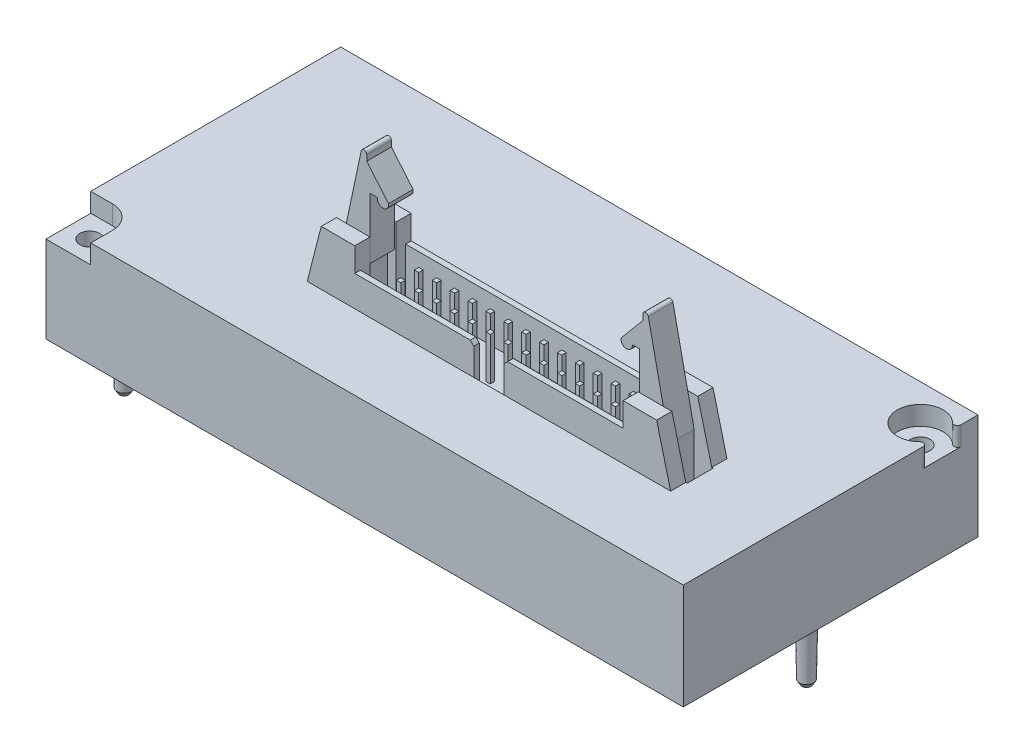
from build123d import *

# Parameters (mm, degrees)
SKETCH1_W                = 90.5
SKETCH1_H                = 41.85
SKETCH1_R                = 1.4
BOSS_EXTRUDE1_DEPTH      = 15
SKETCH2_W                = 105
SKETCH2_H                = 60
CUT_EXTRUDE1_DEPTH       = 2.7
BOSS_EXTRUDE2_DEPTH      = 4
BOSS_EXTRUDE2_DEPTH_BACK = 4
CUT_EXTRUDE2_DEPTH       = 6.4
CUT_EXTRUDE2_DEPTH_BACK  = 6.4
SKETCH7_W                = 38.1
SKETCH7_H                = 6.43
CUT_EXTRUDE3_DEPTH       = 1
SKETCH9_W                = 3.68
SKETCH9_H                = 13
CUT_EXTRUDE4_DEPTH       = 7
SKETCH10_W               = 3.68
SKETCH10_H               = 13
CUT_EXTRUDE5_DEPTH       = 7
BOSS_EXTRUDE3_DEPTH      = 3
BOSS_EXTRUDE3_DEPTH_BACK = 3
SKETCH11_R               = 0.5
BOSS_EXTRUDE4_DEPTH      = 3
BOSS_EXTRUDE4_DEPTH_BACK = 3
SKETCH12_R               = 0.5
BOSS_EXTRUDE5_DEPTH      = 1.75
BOSS_EXTRUDE5_DEPTH_BACK = 1.75
BOSS_EXTRUDE6_DEPTH      = 1.75
BOSS_EXTRUDE6_DEPTH_BACK = 1.75
SKETCH15_W               = 0.62
SKETCH15_H               = 0.62
BOSS_EXTRUDE7_DEPTH      = 6.1
SKETCH16_W               = 0.62
SKETCH16_H               = 0.62
BOSS_EXTRUDE8_DEPTH      = 6.1
SKETCH17_W               = 0.62
SKETCH17_H               = 0.62
BOSS_EXTRUDE9_DEPTH      = 6.1
SKETCH18_W               = 0.62
SKETCH18_H               = 0.62
BOSS_EXTRUDE10_DEPTH     = 6.1
SKETCH19_W               = 0.62
SKETCH19_H               = 0.62
BOSS_EXTRUDE11_DEPTH     = 6.1
SKETCH20_W               = 0.62
SKETCH20_H               = 0.62
BOSS_EXTRUDE12_DEPTH     = 6.1
SKETCH21_W               = 0.62
SKETCH21_H               = 0.62
BOSS_EXTRUDE13_DEPTH     = 6.1
SKETCH22_W               = 0.62
SKETCH22_H               = 0.62
BOSS_EXTRUDE14_DEPTH     = 6.1
SKETCH23_W               = 0.62
SKETCH23_H               = 0.62
BOSS_EXTRUDE15_DEPTH     = 6.1
SKETCH24_W               = 0.62
SKETCH24_H               = 0.62
BOSS_EXTRUDE16_DEPTH     = 6.1
SKETCH25_W               = 0.62
SKETCH25_H               = 0.62
BOSS_EXTRUDE17_DEPTH     = 6.1
SKETCH26_W               = 0.62
SKETCH26_H               = 0.62
BOSS_EXTRUDE18_DEPTH     = 6.1
SKETCH27_W               = 0.62
SKETCH27_H               = 0.62
BOSS_EXTRUDE19_DEPTH     = 6.1
SKETCH28_W               = 0.62
SKETCH28_H               = 0.62
BOSS_EXTRUDE20_DEPTH     = 6.1
SKETCH29_W               = 0.62
SKETCH29_H               = 0.62
BOSS_EXTRUDE21_DEPTH     = 6.1
SKETCH30_W               = 0.62
SKETCH30_H               = 0.62
BOSS_EXTRUDE22_DEPTH     = 6.1
SKETCH31_W               = 0.62
SKETCH31_H               = 0.62
BOSS_EXTRUDE23_DEPTH     = 6.1
SKETCH32_W               = 0.62
SKETCH32_H               = 0.62
BOSS_EXTRUDE24_DEPTH     = 6.1
SKETCH33_W               = 0.62
SKETCH33_H               = 0.62
BOSS_EXTRUDE25_DEPTH     = 6.1
SKETCH34_W               = 0.62
SKETCH34_H               = 0.62
BOSS_EXTRUDE26_DEPTH     = 6.1
SKETCH35_W               = 0.62
SKETCH35_H               = 0.62
BOSS_EXTRUDE27_DEPTH     = 6.1
SKETCH36_W               = 0.62
SKETCH36_H               = 0.62
BOSS_EXTRUDE28_DEPTH     = 6.1
SKETCH37_W               = 0.62
SKETCH37_H               = 0.62
BOSS_EXTRUDE29_DEPTH     = 6.1
SKETCH38_W               = 0.62
SKETCH38_H               = 0.62
BOSS_EXTRUDE30_DEPTH     = 6.1
SKETCH39_W               = 0.62
SKETCH39_H               = 0.62
BOSS_EXTRUDE31_DEPTH     = 6.1
SKETCH40_W               = 0.62
SKETCH40_H               = 0.62
BOSS_EXTRUDE32_DEPTH     = 6.1


with BuildPart() as part:
    # Sketch1 → Boss-Extrude1 (new body)
    with BuildSketch(Plane(origin=(0, 0, 0), x_dir=(1, 0, 0), z_dir=(0, 1, 0))):
        with Locations((11, -5.675)):
            Rectangle(SKETCH1_W, SKETCH1_H)
        with Locations(Location((53.15, 10.15, 0), (0, 0, 270))):
            Circle(SKETCH1_R, mode=Mode.SUBTRACT)
        with Locations(Location((-31.15, -23.5, 0), (0, 0, 270))):
            Circle(SKETCH1_R, mode=Mode.SUBTRACT)
    extrude(amount=BOSS_EXTRUDE1_DEPTH)

    # Sketch2 → Cut-Extrude1 (cut)
    with BuildSketch(Plane(origin=(0, 15, 0), x_dir=(1, 0, 0), z_dir=(0, 1, 0))):
        with Locations((12.5, -5)):
            Rectangle(SKETCH2_W, SKETCH2_H)
        with BuildLine():
            Line((-34.25, 15.25), (-34.25, -20.25))
            Line((-34.25, -20.25), (-31.15, -20.25))
            ThreePointArc((-31.15, -20.25), (-28.851902961, -21.201902961), (-27.9, -23.5))
            Line((-27.9, -23.5), (-27.9, -26.6))
            Line((-27.9, -26.6), (56.25, -26.6))
            Line((56.25, -26.6), (56.25, 7.447686177))
            ThreePointArc((56.25, 7.447686177), (55.945788972, 7.907758648), (55.403333286, 7.807994641))
            ThreePointArc((55.403333286, 7.807994641), (49.9, 10.150000033), (55.403333333, 12.492005314))
            ThreePointArc((55.403333333, 12.492005314), (55.945789002, 12.392241365), (56.25, 12.852313823))
            Line((56.25, 12.852313823), (56.25, 15.25))
            Line((56.25, 15.25), (-34.25, 15.25))
        make_face(mode=Mode.SUBTRACT)
    extrude(amount=-CUT_EXTRUDE1_DEPTH, mode=Mode.SUBTRACT)

    # Sketch3 → Revolve1 (revolve)
    with BuildSketch(Plane.XY.offset(6), mode=Mode.PRIVATE) as revolve1_sk:
        Polygon((53.15, 0), (54.3, 0), (54.15, -8.4), (53.8, -9), (53.15, -9), align=None)
    revolve(revolve1_sk.sketch.rotate(Axis((53.15, -9, 6), (0, 1, 0)), 270), axis=Axis((53.15, -9, 6), (0, 1, 0)))

    # Sketch4 → Revolve2 (revolve)
    with BuildSketch(Plane.XY.offset(-5.25), mode=Mode.PRIVATE) as revolve2_sk:
        Polygon((-31.15, 0), (-30, 0), (-30.15, -8.4), (-30.5, -9), (-31.15, -9), align=None)
    revolve(revolve2_sk.sketch.rotate(Axis((-31.15, -9, -5.25), (0, 1, 0)), 270), axis=Axis((-31.15, -9, -5.25), (0, 1, 0)))

    # Sketch5 → Revolve3 (revolve)
    with BuildSketch(Plane.XY.offset(18.6), mode=Mode.PRIVATE) as revolve3_sk:
        Polygon((-31.15, 0), (-30, 0), (-30.15, -8.4), (-30.5, -9), (-31.15, -9), align=None)
    revolve(revolve3_sk.sketch.rotate(Axis((-31.15, -9, 18.6), (0, 1, 0)), 270), axis=Axis((-31.15, -9, 18.6), (0, 1, 0)))

    # Sketch6 → Boss-Extrude2 (add, two sides: drawn at the far end of the back side and taken through both)
    with BuildSketch(Plane.XY.offset(11.95).offset(-BOSS_EXTRUDE2_DEPTH_BACK)):
        Polygon((-8.225, 13.35), (-8.225, 5.35), (44.225, 5.35), (44.225, 13.35), (41.815, 22.75), (37.05, 22.75), (37.05, 19.35), (-1.05, 19.35), (-1.05, 22.75), (-5.815, 22.75), align=None)
    extrude(amount=BOSS_EXTRUDE2_DEPTH + BOSS_EXTRUDE2_DEPTH_BACK)

    # Sketch7 → Cut-Extrude2 (cut, two sides: drawn at the far end of the back side and taken through both)
    with BuildSketch(Plane(origin=(0, 19.35, 0), x_dir=(1, 0, 0), z_dir=(0, 1, 0)).offset(-CUT_EXTRUDE2_DEPTH_BACK)):
        with Locations((18, -11.95)):
            Rectangle(SKETCH7_W, SKETCH7_H)
    extrude(amount=CUT_EXTRUDE2_DEPTH + CUT_EXTRUDE2_DEPTH_BACK, mode=Mode.SUBTRACT)

    # Sketch8 → Cut-Extrude3 (cut)
    with BuildSketch(Plane.XY.offset(15.95)):
        Polygon((15.35, 19.35), (15.85, 18.85), (15.85, 13.45), (16.35, 12.95), (19.65, 12.95), (20.15, 13.45), (20.15, 18.85), (20.65, 19.35), align=None)
    extrude(amount=-CUT_EXTRUDE3_DEPTH, mode=Mode.SUBTRACT)

    # Sketch9 → Cut-Extrude4 (cut)
    with BuildSketch(Plane(origin=(37, 0, 0), x_dir=(0, 0, -1), z_dir=(1, 0, 0))):
        with Locations((-11.95, 16.25)):
            Rectangle(SKETCH9_W, SKETCH9_H)
    extrude(amount=CUT_EXTRUDE4_DEPTH, mode=Mode.SUBTRACT)

    # Sketch10 → Cut-Extrude5 (cut)
    with BuildSketch(Plane(origin=(-1.05, 0, 0), x_dir=(0, 0, -1), z_dir=(1, 0, 0))):
        with Locations((-11.95, 16.25)):
            Rectangle(SKETCH10_W, SKETCH10_H)
    extrude(amount=-CUT_EXTRUDE5_DEPTH, mode=Mode.SUBTRACT)

    # Sketch11 → Boss-Extrude3 (add, two sides: drawn at the far end of the back side and taken through both)
    with BuildSketch(Plane.XY.offset(11.95).offset(-BOSS_EXTRUDE3_DEPTH_BACK)):
        with Locations(Location((40.225, 15.21, 0), (0, 0, 180))):
            Circle(SKETCH11_R)
    extrude(amount=BOSS_EXTRUDE3_DEPTH + BOSS_EXTRUDE3_DEPTH_BACK)

    # Sketch12 → Boss-Extrude4 (add, two sides: drawn at the far end of the back side and taken through both)
    with BuildSketch(Plane.XY.offset(11.95).offset(-BOSS_EXTRUDE4_DEPTH_BACK)):
        with Locations(Location((-4.225, 15.21, 0), (0, 0, 180))):
            Circle(SKETCH12_R)
    extrude(amount=BOSS_EXTRUDE4_DEPTH + BOSS_EXTRUDE4_DEPTH_BACK)

    # Sketch13 → Boss-Extrude5 (add, two sides: drawn at the far end of the back side and taken through both)
    with BuildSketch(Plane.XY.offset(11.95).offset(-BOSS_EXTRUDE5_DEPTH_BACK)):
        with BuildLine():
            Line((36.100152425, 28.044506131), (37.155, 28.044506131))
            Line((37.155, 28.044506131), (37.155, 19.373))
            Line((37.155, 19.373), (38.155, 19.373))
            Line((38.155, 19.373), (38.155, 11.97026486))
            ThreePointArc((38.155, 11.97026486), (39.77, 11.15), (41.385, 11.97026486))
            Line((41.385, 11.97026486), (41.385, 18.512181097))
            Line((41.385, 18.512181097), (38.391302756, 32.632958744))
            ThreePointArc((38.391302756, 32.632958744), (37.9582933, 32.947819747), (37.6, 32.55))
            Line((37.6, 32.55), (37.6, 31.75))
            Line((37.6, 31.75), (34.514619474, 28.072986673))
            ThreePointArc((34.514619474, 28.072986673), (35.29056123, 27.122101776), (36.100152425, 28.044506131))
        make_face()
    extrude(amount=BOSS_EXTRUDE5_DEPTH + BOSS_EXTRUDE5_DEPTH_BACK)

    # Sketch14 → Boss-Extrude6 (add, two sides: drawn at the far end of the back side and taken through both)
    with BuildSketch(Plane.XY.offset(11.95).offset(-BOSS_EXTRUDE6_DEPTH_BACK)):
        with BuildLine():
            Line((-5.385, 18.512181097), (-5.385, 11.97026486))
            ThreePointArc((-5.385, 11.97026486), (-3.77, 11.15), (-2.155, 11.97026486))
            Line((-2.155, 11.97026486), (-2.155, 19.373))
            Line((-2.155, 19.373), (-1.155, 19.373))
            Line((-1.155, 19.373), (-1.155, 28.044506131))
            Line((-1.155, 28.044506131), (-0.100152425, 28.044506131))
            ThreePointArc((-0.100152425, 28.044506131), (0.70943877, 27.122101776), (1.485380526, 28.072986673))
            Line((1.485380526, 28.072986673), (-1.6, 31.75))
            Line((-1.6, 31.75), (-1.6, 32.55))
            ThreePointArc((-1.6, 32.55), (-1.9582933, 32.947819747), (-2.391302756, 32.632958744))
            Line((-2.391302756, 32.632958744), (-5.385, 18.512181097))
        make_face()
    extrude(amount=BOSS_EXTRUDE6_DEPTH + BOSS_EXTRUDE6_DEPTH_BACK)

    # Sketch15 → Boss-Extrude7 (add)
    with BuildSketch(Plane(origin=(0, 12.95, 0), x_dir=(1, 0, 0), z_dir=(0, 1, 0))):
        with Locations((2.76, -13.22)):
            Rectangle(SKETCH15_W, SKETCH15_H)
    extrude(amount=BOSS_EXTRUDE7_DEPTH)

    # Sketch16 → Boss-Extrude8 (add)
    with BuildSketch(Plane(origin=(0, 12.95, 0), x_dir=(1, 0, 0), z_dir=(0, 1, 0))):
        with Locations((5.3, -13.22)):
            Rectangle(SKETCH16_W, SKETCH16_H)
    extrude(amount=BOSS_EXTRUDE8_DEPTH)

    # Sketch17 → Boss-Extrude9 (add)
    with BuildSketch(Plane(origin=(0, 12.95, 0), x_dir=(1, 0, 0), z_dir=(0, 1, 0))):
        with Locations((7.84, -13.22)):
            Rectangle(SKETCH17_W, SKETCH17_H)
    extrude(amount=BOSS_EXTRUDE9_DEPTH)

    # Sketch18 → Boss-Extrude10 (add)
    with BuildSketch(Plane(origin=(0, 12.95, 0), x_dir=(1, 0, 0), z_dir=(0, 1, 0))):
        with Locations((10.38, -13.22)):
            Rectangle(SKETCH18_W, SKETCH18_H)
    extrude(amount=BOSS_EXTRUDE10_DEPTH)

    # Sketch19 → Boss-Extrude11 (add)
    with BuildSketch(Plane(origin=(0, 12.95, 0), x_dir=(1, 0, 0), z_dir=(0, 1, 0))):
        with Locations((12.92, -13.22)):
            Rectangle(SKETCH19_W, SKETCH19_H)
    extrude(amount=BOSS_EXTRUDE11_DEPTH)

    # Sketch20 → Boss-Extrude12 (add)
    with BuildSketch(Plane(origin=(0, 12.95, 0), x_dir=(1, 0, 0), z_dir=(0, 1, 0))):
        with Locations((15.46, -13.22)):
            Rectangle(SKETCH20_W, SKETCH20_H)
    extrude(amount=BOSS_EXTRUDE12_DEPTH)

    # Sketch21 → Boss-Extrude13 (add)
    with BuildSketch(Plane(origin=(0, 12.95, 0), x_dir=(1, 0, 0), z_dir=(0, 1, 0))):
        with Locations((18, -13.22)):
            Rectangle(SKETCH21_W, SKETCH21_H)
    extrude(amount=BOSS_EXTRUDE13_DEPTH)

    # Sketch22 → Boss-Extrude14 (add)
    with BuildSketch(Plane(origin=(0, 12.95, 0), x_dir=(1, 0, 0), z_dir=(0, 1, 0))):
        with Locations((20.54, -13.22)):
            Rectangle(SKETCH22_W, SKETCH22_H)
    extrude(amount=BOSS_EXTRUDE14_DEPTH)

    # Sketch23 → Boss-Extrude15 (add)
    with BuildSketch(Plane(origin=(0, 12.95, 0), x_dir=(1, 0, 0), z_dir=(0, 1, 0))):
        with Locations((23.08, -13.22)):
            Rectangle(SKETCH23_W, SKETCH23_H)
    extrude(amount=BOSS_EXTRUDE15_DEPTH)

    # Sketch24 → Boss-Extrude16 (add)
    with BuildSketch(Plane(origin=(0, 12.95, 0), x_dir=(1, 0, 0), z_dir=(0, 1, 0))):
        with Locations((25.62, -13.22)):
            Rectangle(SKETCH24_W, SKETCH24_H)
    extrude(amount=BOSS_EXTRUDE16_DEPTH)

    # Sketch25 → Boss-Extrude17 (add)
    with BuildSketch(Plane(origin=(0, 12.95, 0), x_dir=(1, 0, 0), z_dir=(0, 1, 0))):
        with Locations((28.16, -13.22)):
            Rectangle(SKETCH25_W, SKETCH25_H)
    extrude(amount=BOSS_EXTRUDE17_DEPTH)

    # Sketch26 → Boss-Extrude18 (add)
    with BuildSketch(Plane(origin=(0, 12.95, 0), x_dir=(1, 0, 0), z_dir=(0, 1, 0))):
        with Locations((30.7, -13.22)):
            Rectangle(SKETCH26_W, SKETCH26_H)
    extrude(amount=BOSS_EXTRUDE18_DEPTH)

    # Sketch27 → Boss-Extrude19 (add)
    with BuildSketch(Plane(origin=(0, 12.95, 0), x_dir=(1, 0, 0), z_dir=(0, 1, 0))):
        with Locations((33.24, -13.22)):
            Rectangle(SKETCH27_W, SKETCH27_H)
    extrude(amount=BOSS_EXTRUDE19_DEPTH)

    # Sketch28 → Boss-Extrude20 (add)
    with BuildSketch(Plane(origin=(0, 12.95, 0), x_dir=(1, 0, 0), z_dir=(0, 1, 0))):
        with Locations((2.76, -10.68)):
            Rectangle(SKETCH28_W, SKETCH28_H)
    extrude(amount=BOSS_EXTRUDE20_DEPTH)

    # Sketch29 → Boss-Extrude21 (add)
    with BuildSketch(Plane(origin=(0, 12.95, 0), x_dir=(1, 0, 0), z_dir=(0, 1, 0))):
        with Locations((5.3, -10.68)):
            Rectangle(SKETCH29_W, SKETCH29_H)
    extrude(amount=BOSS_EXTRUDE21_DEPTH)

    # Sketch30 → Boss-Extrude22 (add)
    with BuildSketch(Plane(origin=(0, 12.95, 0), x_dir=(1, 0, 0), z_dir=(0, 1, 0))):
        with Locations((7.84, -10.68)):
            Rectangle(SKETCH30_W, SKETCH30_H)
    extrude(amount=BOSS_EXTRUDE22_DEPTH)

    # Sketch31 → Boss-Extrude23 (add)
    with BuildSketch(Plane(origin=(0, 12.95, 0), x_dir=(1, 0, 0), z_dir=(0, 1, 0))):
        with Locations((10.38, -10.68)):
            Rectangle(SKETCH31_W, SKETCH31_H)
    extrude(amount=BOSS_EXTRUDE23_DEPTH)

    # Sketch32 → Boss-Extrude24 (add)
    with BuildSketch(Plane(origin=(0, 12.95, 0), x_dir=(1, 0, 0), z_dir=(0, 1, 0))):
        with Locations((12.92, -10.68)):
            Rectangle(SKETCH32_W, SKETCH32_H)
    extrude(amount=BOSS_EXTRUDE24_DEPTH)

    # Sketch33 → Boss-Extrude25 (add)
    with BuildSketch(Plane(origin=(0, 12.95, 0), x_dir=(1, 0, 0), z_dir=(0, 1, 0))):
        with Locations((15.46, -10.68)):
            Rectangle(SKETCH33_W, SKETCH33_H)
    extrude(amount=BOSS_EXTRUDE25_DEPTH)

    # Sketch34 → Boss-Extrude26 (add)
    with BuildSketch(Plane(origin=(0, 12.95, 0), x_dir=(1, 0, 0), z_dir=(0, 1, 0))):
        with Locations((18, -10.68)):
            Rectangle(SKETCH34_W, SKETCH34_H)
    extrude(amount=BOSS_EXTRUDE26_DEPTH)

    # Sketch35 → Boss-Extrude27 (add)
    with BuildSketch(Plane(origin=(0, 12.95, 0), x_dir=(1, 0, 0), z_dir=(0, 1, 0))):
        with Locations((20.54, -10.68)):
            Rectangle(SKETCH35_W, SKETCH35_H)
    extrude(amount=BOSS_EXTRUDE27_DEPTH)

    # Sketch36 → Boss-Extrude28 (add)
    with BuildSketch(Plane(origin=(0, 12.95, 0), x_dir=(1, 0, 0), z_dir=(0, 1, 0))):
        with Locations((23.08, -10.68)):
            Rectangle(SKETCH36_W, SKETCH36_H)
    extrude(amount=BOSS_EXTRUDE28_DEPTH)

    # Sketch37 → Boss-Extrude29 (add)
    with BuildSketch(Plane(origin=(0, 12.95, 0), x_dir=(1, 0, 0), z_dir=(0, 1, 0))):
        with Locations((25.62, -10.68)):
            Rectangle(SKETCH37_W, SKETCH37_H)
    extrude(amount=BOSS_EXTRUDE29_DEPTH)

    # Sketch38 → Boss-Extrude30 (add)
    with BuildSketch(Plane(origin=(0, 12.95, 0), x_dir=(1, 0, 0), z_dir=(0, 1, 0))):
        with Locations((28.16, -10.68)):
            Rectangle(SKETCH38_W, SKETCH38_H)
    extrude(amount=BOSS_EXTRUDE30_DEPTH)

    # Sketch39 → Boss-Extrude31 (add)
    with BuildSketch(Plane(origin=(0, 12.95, 0), x_dir=(1, 0, 0), z_dir=(0, 1, 0))):
        with Locations((30.7, -10.68)):
            Rectangle(SKETCH39_W, SKETCH39_H)
    extrude(amount=BOSS_EXTRUDE31_DEPTH)

    # Sketch40 → Boss-Extrude32 (add)
    with BuildSketch(Plane(origin=(0, 12.95, 0), x_dir=(1, 0, 0), z_dir=(0, 1, 0))):
        with Locations((33.24, -10.68)):
            Rectangle(SKETCH40_W, SKETCH40_H)
    extrude(amount=BOSS_EXTRUDE32_DEPTH)


solid = part.part
